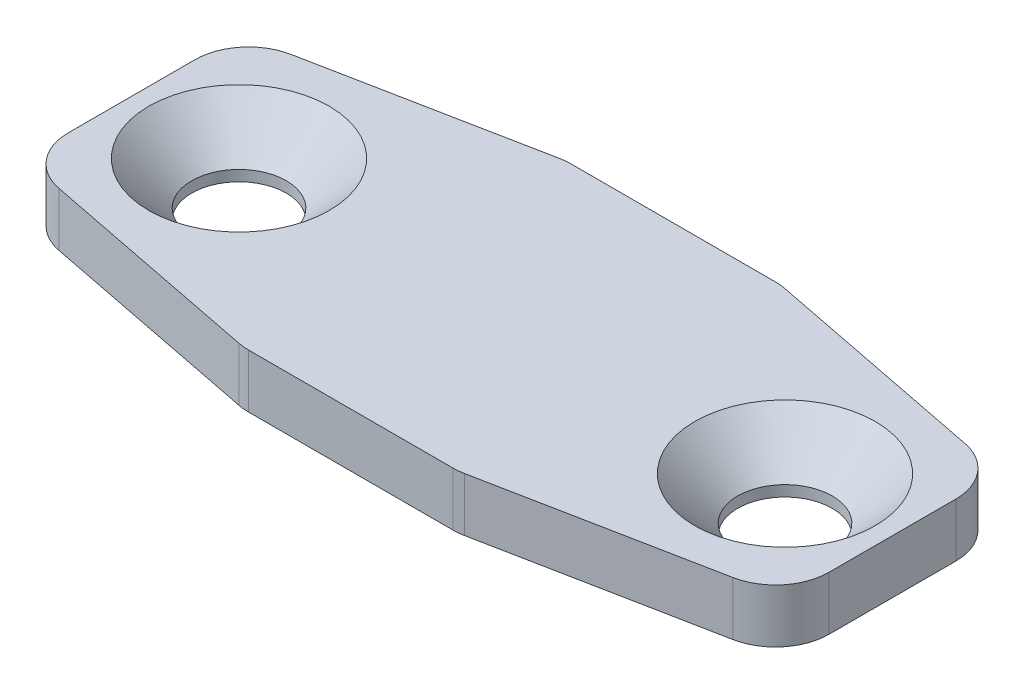
from build123d import *

# Parameters (mm, degrees)
BOSS_EXTRUDE1_DEPTH = 2.5
CUT_EXTRUDE2_REACH  = 21.385
SKETCH2_R           = 2.2
CHAMFER1_SIZE       = 2
FILLET1_R           = 2.5


with BuildPart() as part:
    # Sketch1 → Boss-Extrude1 (new body)
    with BuildSketch(Plane(origin=(0, 0, 0), x_dir=(1, 0, 0), z_dir=(0, 1, 0))):
        Polygon((-17.7, -5), (-5, -7.5), (5, -7.5), (17.7, -5), (17.7, 5), (5, 7.5), (-5, 7.5), (-17.7, 5), align=None)
    extrude(amount=BOSS_EXTRUDE1_DEPTH)

    # Sketch2 → Cut-Extrude2 (cut, up to next)
    with BuildSketch(Plane(origin=(0, 2.5, 0), x_dir=(1, 0, 0), z_dir=(0, 1, 0)), mode=Mode.PRIVATE) as cut_extrude2_sk1:
        with Locations(Location((-12.7, 0, 0), (0, 0, 270))):
            Circle(SKETCH2_R)
    cut_extrude2_tool1 = extrude(cut_extrude2_sk1.sketch, amount=-CUT_EXTRUDE2_REACH, mode=Mode.PRIVATE) & part.part
    # Sketch2 → Cut-Extrude2 (cut, up to next)
    with BuildSketch(Plane(origin=(0, 2.5, 0), x_dir=(1, 0, 0), z_dir=(0, 1, 0)), mode=Mode.PRIVATE) as cut_extrude2_sk2:
        with Locations(Location((12.7, 0, 0), (0, 0, 270))):
            Circle(SKETCH2_R)
    cut_extrude2_tool2 = extrude(cut_extrude2_sk2.sketch, amount=-CUT_EXTRUDE2_REACH, mode=Mode.PRIVATE) & part.part
    add(cut_extrude2_tool1.solids().sort_by_distance((-12.7, 2.5, 0))[0], mode=Mode.SUBTRACT)
    add(cut_extrude2_tool2.solids().sort_by_distance((12.7, 2.5, 0))[0], mode=Mode.SUBTRACT)

    # Chamfer1
    chamfer1_edges = [part.edges().sort_by_distance(p)[0] for p in [
        (-12.7, 2.5, -2.2),
        (12.7, 2.5, -2.2),
    ]]
    chamfer(chamfer1_edges, length=CHAMFER1_SIZE)

    # Fillet1
    fillet1_edges = [part.edges().sort_by_distance(p)[0] for p in [
        (5, 1.25, -7.5),
        (17.7, 1.25, -5),
        (17.7, 1.25, 5),
        (5, 1.25, 7.5),
        (-5, 1.25, 7.5),
        (-17.7, 1.25, 5),
        (-17.7, 1.25, -5),
        (-5, 1.25, -7.5),
    ]]
    fillet(fillet1_edges, radius=FILLET1_R)


solid = part.part
